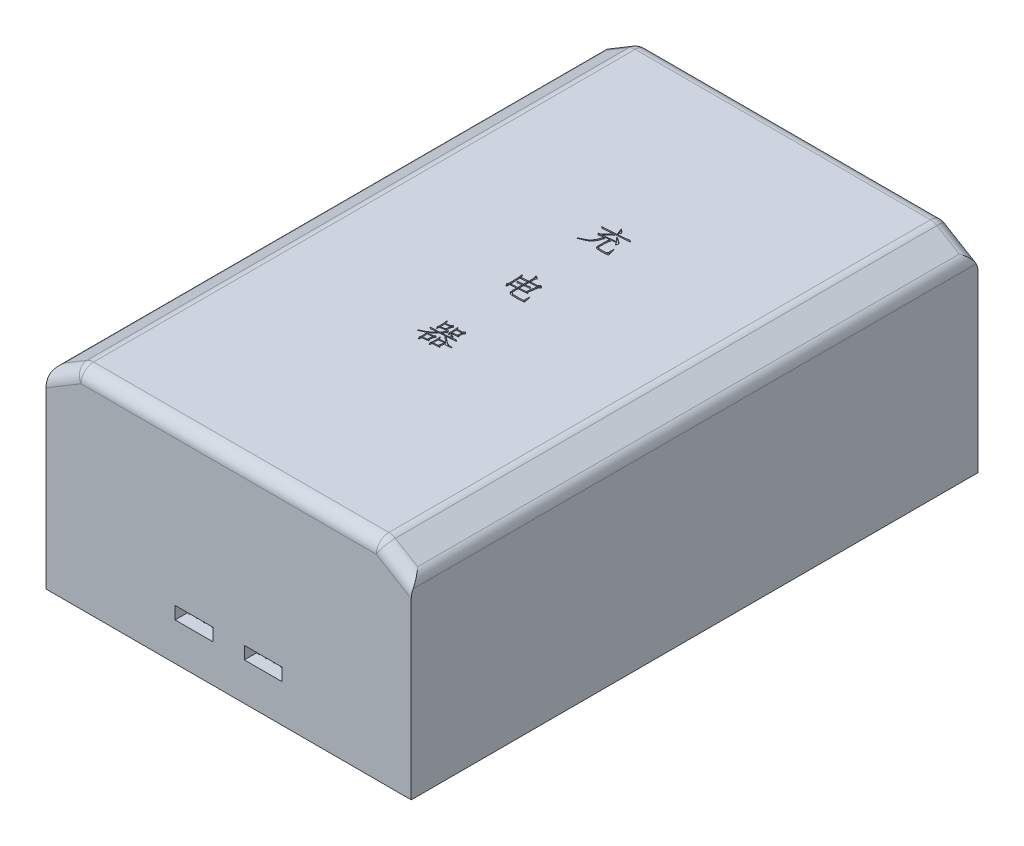
from build123d import *

# Parameters (mm, degrees)
SKETCH_1_W          = 58
SKETCH_1_H          = 90
EXTRUDE_1_DEPTH     = 33
CUT_EXTRUDE_1_DEPTH = 113.040171367
FILLET_1_R          = 2
CUT_EXTRUDE_2_DEPTH = 0.2
SKETCH_4_W          = 6
SKETCH_4_H          = 2
CUT_EXTRUDE_3_DEPTH = 6
SKETCH_5_R          = 0.15
EXTRUDE_2_DEPTH     = 5
FILLET_2_R          = 0.1
CUT_EXTRUDE_4_DEPTH = 5


with BuildPart() as part:
    # 草图1 → 凸台-拉伸1 (new body)
    with BuildSketch(Plane(origin=(0, 0, 0), x_dir=(1, 0, 0), z_dir=(0, 1, 0))):
        with Locations((-29, 45)):
            Rectangle(SKETCH_1_W, SKETCH_1_H)
    extrude(amount=EXTRUDE_1_DEPTH)

    # 草图2 → 切除-拉伸1 (cut, through all)
    with BuildSketch(Plane.XY):
        Polygon((-53, 33), (-58, 30), (-58, 33), align=None)
        Polygon((0, 30), (0, 33), (-5, 33), align=None)
    extrude(amount=-CUT_EXTRUDE_1_DEPTH, mode=Mode.SUBTRACT)

    # 圆角1
    fillet_1_edges = [part.edges().sort_by_distance(p)[0] for p in [
        (-29, 33, -90),
        (-29, 33, 0),
        (-55.5, 31.5, -90),
        (-53, 33, -45),
        (-58, 30, -45),
        (-55.5, 31.5, 0),
        (-2.5, 31.5, -90),
        (0, 30, -45),
        (-5, 33, -45),
        (-2.5, 31.5, 0),
    ]]
    fillet(fillet_1_edges, radius=FILLET_1_R)

    # 草图3 → 切除-拉伸2 (cut)
    # profile 1 of 6: a face of its own
    with BuildSketch(Plane(origin=(0, 33, 0), x_dir=(1, 0, 0), z_dir=(0, 1, 0))):
        with BuildLine():
            Line((-31.113002733, 57.493892761), (-31.040660948, 57.523724425))
            add(Edge.make_bspline(
                [(-31.040660948, 57.523724425), (-30.973644608, 57.551478353), (-30.838365924, 57.607502226), (-30.636604807, 57.698393291), (-30.434289975, 57.796832022), (-30.26548757, 57.882018347), (-30.133171269, 57.955595568), (-30.039408624, 58.015598601), (-29.950051839, 58.077840953), (-29.867497656, 58.145127689), (-29.790508957, 58.215778503), (-29.717521496, 58.288515657), (-29.651404636, 58.366159349), (-29.591443912, 58.446843309), (-29.536356817, 58.52736139), (-29.485365434, 58.605547632), (-29.439996139, 58.68152276), (-29.397579946, 58.753901661), (-29.362509679, 58.824960577), (-29.33040099, 58.892162878), (-29.304336756, 58.95728534), (-29.276675793, 59.038140258), (-29.249521137, 59.131401083), (-29.218625179, 59.231330154), (-29.196685652, 59.317693785), (-29.178967486, 59.389729941), (-29.166742502, 59.44941408), (-29.155897923, 59.497005057), (-29.148643528, 59.53364444), (-29.144371619, 59.554268497), (-29.142621314, 59.562718672)],
                knots=[0, 0, 0, 0, 2.061159307, 4.160640874, 6.287012338, 8.454376887, 9.533022146, 10.587381967, 11.616374519, 12.625880149, 13.610966308, 14.585048418, 15.552034607, 16.505717542, 17.440399167, 18.324116836, 19.157646495, 19.955007434, 20.70691773, 21.408529353, 22.070995169, 22.69876626, 23.836209216, 24.830874226, 25.67045884, 26.367825475, 26.938681821, 27.401489014, 27.754775552, 28, 28, 28, 28], degree=3))
            Line((-29.142621314, 59.562718672), (-29.134417606, 59.698452744))
            Line((-29.134417606, 59.698452744), (-29.366358795, 59.648484707))
            Line((-29.366358795, 59.648484707), (-29.639318523, 59.588075587))
            Line((-29.639318523, 59.588075587), (-29.855598088, 59.532887008))
            Line((-29.855598088, 59.532887008), (-29.911532458, 59.593296128))
            Line((-29.911532458, 59.593296128), (-30.055470238, 59.749166573))
            add(Edge.make_bspline(
                [(-30.055470238, 59.749166573), (-30.062782404, 59.758926519), (-30.073741764, 59.773554574), (-30.094438641, 59.789310611), (-30.08932135, 59.802660284), (-30.075680473, 59.807429131), (-30.05699625, 59.816251947), (-30.040940423, 59.821462118), (-30.031604907, 59.824491525)],
                knots=[0, 0, 0, 0, 1.81508851, 2.720426484, 3.020159823, 3.633829035, 4.624211136, 6, 6, 6, 6], degree=3))
            Line((-30.031604907, 59.824491525), (-29.863056004, 59.84984844))
            add(Edge.make_bspline(
                [(-29.863056004, 59.84984844), (-29.85092535, 59.85362833), (-29.823104523, 59.86229725), (-29.781273457, 59.888907951), (-29.73169467, 59.924099708), (-29.675270592, 59.970641177), (-29.611947753, 60.028496219), (-29.541475869, 60.097053409), (-29.463462761, 60.176225238), (-29.3827455, 60.264513794), (-29.301701608, 60.353260992), (-29.226943209, 60.436578966), (-29.159921341, 60.510338945), (-29.103113145, 60.576013373), (-29.053845488, 60.631781679), (-29.015011567, 60.679799543), (-28.982836134, 60.717465769), (-28.965764801, 60.740739016), (-28.958410788, 60.750764698)],
                knots=[0, 0, 0, 0, 0.47279427, 1.084321388, 1.836616624, 2.747281282, 3.812159307, 5.040032267, 6.41881215, 7.962793582, 9.507333254, 10.90761013, 12.143635294, 13.229317833, 14.150804513, 14.922334459, 15.535761718, 16, 16, 16, 16], degree=3))
            Line((-28.958410788, 60.750764698), (-28.845796255, 60.906635143))
            add(Edge.make_bspline(
                [(-28.845796255, 60.906635143), (-28.932318543, 60.900817912), (-29.099196752, 60.889598039), (-29.34010246, 60.870985867), (-29.562600894, 60.851546606), (-29.767048154, 60.831917188), (-29.953160178, 60.809860246), (-30.121388882, 60.788889709), (-30.271024299, 60.76579023), (-30.364506258, 60.748947223), (-30.408229667, 60.741069407)],
                knots=[0, 0, 0, 0, 1.323898549, 2.553444044, 3.688737392, 4.733683834, 5.688868987, 6.549873273, 7.321746311, 8, 8, 8, 8], degree=3))
            Line((-30.408229667, 60.741069407), (-30.640170856, 60.891719311))
            add(Edge.make_bspline(
                [(-30.640170856, 60.891719311), (-30.648365047, 60.897110244), (-30.66304678, 60.90676931), (-30.682673527, 60.920602203), (-30.693568218, 60.932771935), (-30.703181443, 60.944234287), (-30.692698767, 60.957273468), (-30.67065336, 60.960910984), (-30.636582874, 60.968787501), (-30.608687251, 60.970984956), (-30.592440193, 60.972264805)],
                knots=[0, 0, 0, 0, 1.205272087, 2.159515554, 2.868960972, 3.317653652, 3.713881685, 4.588861437, 6.013273903, 8, 8, 8, 8], degree=3))
            Line((-30.592440193, 60.972264805), (-29.518500283, 61.043115007))
            Line((-29.518500283, 61.043115007), (-27.900878293, 61.153492165))
            add(Edge.make_bspline(
                [(-27.900878293, 61.153492165), (-27.831744274, 61.158154538), (-27.698092036, 61.167167996), (-27.505169708, 61.185225175), (-27.32639594, 61.205354463), (-27.161891915, 61.227140031), (-27.011723295, 61.252663933), (-26.87576414, 61.279843365), (-26.753953524, 61.309935206), (-26.678419924, 61.333856854), (-26.642727856, 61.345160607)],
                knots=[0, 0, 0, 0, 1.303486438, 2.519944373, 3.644788666, 4.687821508, 5.641194449, 6.509767222, 7.295816826, 8, 8, 8, 8], degree=3))
            Line((-26.642727856, 61.345160607), (-26.354852296, 61.168407997))
            add(Edge.make_bspline(
                [(-26.354852296, 61.168407997), (-26.348170975, 61.16061061), (-26.335755601, 61.14612134), (-26.323493963, 61.123553519), (-26.33084189, 61.103968452), (-26.351536783, 61.096472944), (-26.380644514, 61.090179044), (-26.40494037, 61.088711289), (-26.418990374, 61.087862503)],
                knots=[0, 0, 0, 0, 1.164271997, 2.163475098, 2.611190826, 3.305674305, 4.441903525, 6, 6, 6, 6], degree=3))
            Line((-26.418990374, 61.087862503), (-28.621312983, 60.937212599))
            Line((-28.621312983, 60.937212599), (-28.48557891, 60.730628325))
            add(Edge.make_bspline(
                [(-28.48557891, 60.730628325), (-28.5095454, 60.722447913), (-28.554401786, 60.707137215), (-28.616381716, 60.681424322), (-28.669029142, 60.656072047), (-28.707982781, 60.63229174), (-28.738590836, 60.60993108), (-28.766176723, 60.586145752), (-28.800274969, 60.556334389), (-28.841443815, 60.521005686), (-28.887582887, 60.477826396), (-28.940608883, 60.428951982), (-28.999203125, 60.372919281), (-29.085052461, 60.291220696), (-29.193069584, 60.18686769), (-29.322730129, 60.067236676), (-29.445855763, 59.952883829), (-29.527338858, 59.880055582), (-29.566976737, 59.844627899)],
                knots=[0, 0, 0, 0, 0.86220945, 1.613736529, 2.283893778, 2.85017155, 3.16512732, 3.573784831, 4.089867621, 4.707890261, 5.420901712, 6.241586036, 7.163804253, 8.181775789, 10.27756688, 12.278318206, 14.189568384, 16, 16, 16, 16], degree=3))
            Line((-29.566976737, 59.844627899), (-28.237230306, 59.985582512))
            Line((-28.237230306, 59.985582512), (-27.492184493, 60.071348546))
            Line((-27.492184493, 60.071348546), (-27.780805844, 60.383089437))
            Line((-27.780805844, 60.383089437), (-28.012747033, 60.609810085))
            Line((-28.012747033, 60.609810085), (-28.068681404, 60.670219205))
            Line((-28.068681404, 60.670219205), (-28.012747033, 60.725407784))
            Line((-28.012747033, 60.725407784), (-27.900878293, 60.655303373))
            Line((-27.900878293, 60.655303373), (-27.580187903, 60.443498557))
            Line((-27.580187903, 60.443498557), (-27.291566552, 60.237660074))
            Line((-27.291566552, 60.237660074), (-27.099898109, 60.101180211))
            add(Edge.make_bspline(
                [(-27.099898109, 60.101180211), (-27.085633775, 60.090383999), (-27.060001731, 60.070983936), (-27.027137646, 60.043361375), (-27.006247107, 60.018666283), (-26.993843025, 59.995900932), (-26.993129377, 59.970591839), (-26.992617539, 59.940049715), (-26.997166516, 59.900428875), (-27.00137016, 59.871204027), (-27.003690992, 59.855068981)],
                knots=[0, 0, 0, 0, 1.47326346, 2.647354849, 3.519729378, 4.132847574, 4.729354513, 5.568215301, 6.657411107, 8, 8, 8, 8], degree=3))
            Line((-27.003690992, 59.855068981), (-27.043217947, 59.643264165))
            add(Edge.make_bspline(
                [(-27.043217947, 59.643264165), (-27.04580919, 59.632057467), (-27.050523063, 59.611670738), (-27.058711841, 59.584729957), (-27.068804068, 59.565803265), (-27.079632864, 59.549180103), (-27.104163838, 59.544418974), (-27.116703593, 59.556127055), (-27.123763441, 59.562718672)],
                knots=[0, 0, 0, 0, 1.399593052, 2.546077493, 3.397405988, 4.020252999, 4.885407846, 6, 6, 6, 6], degree=3))
            Line((-27.123763441, 59.562718672), (-27.195359435, 59.678316371))
            Line((-27.195359435, 59.678316371), (-27.379569961, 59.930393933))
            Line((-27.379569961, 59.930393933), (-27.972474287, 59.859543731))
            Line((-27.972474287, 59.859543731), (-28.269299345, 59.819270984))
            Line((-28.269299345, 59.819270984), (-27.980677994, 59.593296128))
            add(Edge.make_bspline(
                [(-27.980677994, 59.593296128), (-27.995393096, 59.578673068), (-28.023192543, 59.551047506), (-28.053965324, 59.512608073), (-28.073203295, 59.476161572), (-28.083174375, 59.438711132), (-28.093739268, 59.392022533), (-28.102006414, 59.337644568), (-28.108061874, 59.28109614), (-28.113553362, 59.227685626), (-28.116807668, 59.179423775), (-28.117045091, 59.149057216), (-28.117157858, 59.134634291)],
                knots=[0, 0, 0, 0, 1.257321427, 2.375304013, 2.968287562, 3.740371106, 4.712725181, 5.871977008, 7.06994215, 8.15985633, 9.12600395, 10, 10, 10, 10], degree=3))
            Line((-28.117157858, 59.134634291), (-28.149226897, 58.118120334))
            add(Edge.make_bspline(
                [(-28.149226897, 58.118120334), (-28.151039257, 58.111699806), (-28.155433511, 58.096132571), (-28.153637665, 58.072919443), (-28.14952257, 58.04831389), (-28.146161657, 58.021303247), (-28.139565597, 57.987935311), (-28.134205021, 57.948094953), (-28.122707995, 57.90517068), (-28.102255505, 57.862201717), (-28.072913043, 57.821599706), (-28.044141785, 57.786549931), (-28.009291292, 57.762735496), (-27.971056789, 57.747912633), (-27.921890446, 57.734435927), (-27.861113252, 57.724754457), (-27.788890674, 57.717543423), (-27.705541017, 57.712595404), (-27.610540107, 57.709442038), (-27.543398179, 57.709919505), (-27.507846117, 57.710172326)],
                knots=[0, 0, 0, 0, 0.394828134, 0.957301572, 1.361175884, 1.884322116, 2.575192127, 3.385241455, 4.27551277, 5.208768111, 6.197943431, 7.255992943, 7.883942779, 8.686388392, 9.684378101, 10.915273482, 12.343453113, 14.003929471, 15.884056182, 18, 18, 18, 18], degree=3))
            add(Edge.make_bspline(
                [(-27.507846117, 57.710172326), (-27.450664129, 57.710122967), (-27.342997991, 57.710030029), (-27.19161032, 57.714357132), (-27.060490532, 57.718583662), (-26.950118416, 57.727096006), (-26.86015661, 57.736024091), (-26.790785263, 57.747544011), (-26.740925765, 57.759946737), (-26.700669885, 57.78176896), (-26.673507818, 57.821570851), (-26.648170466, 57.872281564), (-26.633117057, 57.93444184), (-26.629170885, 57.97884215), (-26.627066232, 58.002522635)],
                knots=[0, 0, 0, 0, 1.95991926, 3.690269324, 5.191205189, 6.455837281, 7.484377104, 8.288501433, 8.865564481, 9.239726547, 9.82794371, 10.472021542, 11.185067124, 12, 12, 12, 12], degree=3))
            Line((-26.627066232, 58.002522635), (-26.627066232, 58.691634078))
            Line((-26.627066232, 58.691634078), (-26.618862524, 58.757263739))
            Line((-26.618862524, 58.757263739), (-26.539062823, 58.76248428))
            Line((-26.539062823, 58.76248428), (-26.5144517, 58.676718246))
            Line((-26.5144517, 58.676718246), (-26.402582959, 58.15317254))
            Line((-26.402582959, 58.15317254), (-26.31457955, 57.765360905))
            Line((-26.31457955, 57.765360905), (-26.274306803, 57.624406292))
            add(Edge.make_bspline(
                [(-26.274306803, 57.624406292), (-26.277962157, 57.618401571), (-26.285977859, 57.60523402), (-26.306772205, 57.590410559), (-26.331980624, 57.575276745), (-26.364277519, 57.562027097), (-26.402639513, 57.549544259), (-26.447860762, 57.538651148), (-26.499050476, 57.528121567), (-26.55710256, 57.519450741), (-26.621473319, 57.511185411), (-26.692369614, 57.504583874), (-26.769727861, 57.499542663), (-26.853515232, 57.495155509), (-26.943998266, 57.491256909), (-27.04096971, 57.489105295), (-27.144396243, 57.488553481), (-27.215495852, 57.488631909), (-27.252039597, 57.48867222)],
                knots=[0, 0, 0, 0, 0.332524827, 0.729182477, 1.197342196, 1.73966079, 2.388956609, 3.122971664, 3.958572195, 4.883463908, 5.924228283, 7.056767034, 8.28202379, 9.625033149, 11.062325413, 12.605617786, 14.255356959, 16, 16, 16, 16], degree=3))
            add(Edge.make_bspline(
                [(-27.252039597, 57.48867222), (-27.315438371, 57.489094873), (-27.435057165, 57.489892321), (-27.604155882, 57.495901632), (-27.752497879, 57.504850498), (-27.880147394, 57.518908141), (-27.987535484, 57.535931007), (-28.074013607, 57.557708291), (-28.141106527, 57.582388663), (-28.199187633, 57.621626543), (-28.246528678, 57.672083286), (-28.291133384, 57.723644829), (-28.32314761, 57.765664216), (-28.342050832, 57.81549682), (-28.3491013, 57.878548531), (-28.359716818, 57.942177888), (-28.365469995, 57.994032544), (-28.367627068, 58.025310054), (-28.368756055, 58.047429372), (-28.366389522, 58.058719065), (-28.365506462, 58.062931755)],
                knots=[0, 0, 0, 0, 2.346713137, 4.427703807, 6.262836898, 7.846089821, 9.180402993, 10.282973817, 11.145918589, 11.809495769, 12.857128423, 13.692550747, 14.340894988, 14.795448151, 15.645689873, 16.677686556, 17.186808054, 17.574283458, 17.841146092, 18, 18, 18, 18], degree=3))
            Line((-28.365506462, 58.062931755), (-28.365506462, 58.147951998))
            Line((-28.365506462, 58.147951998), (-28.333437423, 59.180127579))
            add(Edge.make_bspline(
                [(-28.333437423, 59.180127579), (-28.33355656, 59.203498599), (-28.333825329, 59.256222898), (-28.337564549, 59.343950473), (-28.340800014, 59.448126354), (-28.345093104, 59.541813486), (-28.346613819, 59.615677812), (-28.348275171, 59.660659658), (-28.349202894, 59.693725629), (-28.349128121, 59.711628132), (-28.349099047, 59.718589117)],
                knots=[0, 0, 0, 0, 1.041113228, 2.348719285, 3.911282286, 5.684535143, 6.526530033, 7.202470855, 7.689898713, 8, 8, 8, 8], degree=3))
            Line((-28.349099047, 59.718589117), (-28.381168086, 59.819270984))
            Line((-28.381168086, 59.819270984), (-29.014345158, 59.714114368))
            Line((-29.014345158, 59.714114368), (-28.789861885, 59.512750635))
            add(Edge.make_bspline(
                [(-28.789861885, 59.512750635), (-28.803825968, 59.500655079), (-28.828182238, 59.47955791), (-28.859471393, 59.4447357), (-28.881894068, 59.401650262), (-28.903448825, 59.349582214), (-28.924864716, 59.291382564), (-28.94204357, 59.253376772), (-28.95020708, 59.235316158)],
                knots=[0, 0, 0, 0, 1.02237023, 1.783226751, 2.571439814, 3.692993896, 4.903694781, 6, 6, 6, 6], degree=3))
            Line((-28.95020708, 59.235316158), (-29.053872113, 58.938491099))
            add(Edge.make_bspline(
                [(-29.053872113, 58.938491099), (-29.071743846, 58.895494852), (-29.109592223, 58.804438309), (-29.180510602, 58.665680131), (-29.265452531, 58.516374786), (-29.345018882, 58.385941835), (-29.419574336, 58.279314835), (-29.486892839, 58.201053823), (-29.563994469, 58.12674581), (-29.649920751, 58.055470051), (-29.744522958, 57.986697476), (-29.849409974, 57.922252949), (-29.96288344, 57.860176331), (-30.124395555, 57.783576067), (-30.327355346, 57.695694972), (-30.564413531, 57.597993234), (-30.789543273, 57.509825709), (-30.937084883, 57.458405021), (-31.008591909, 57.433483641)],
                knots=[0, 0, 0, 0, 0.867378823, 1.836916522, 2.90104065, 4.068222218, 4.682652781, 5.323277335, 5.988292146, 6.675710901, 7.402165728, 8.165719603, 8.967975304, 9.811231328, 11.495559834, 13.088750289, 14.589043389, 16, 16, 16, 16], degree=3))
            Line((-31.008591909, 57.433483641), (-31.080933694, 57.408126727))
            Line((-31.080933694, 57.408126727), (-31.113002733, 57.493892761))
        make_face()
    # profile 2 of 6: a face of its own
    with BuildSketch(Plane(origin=(0, 33, 0), x_dir=(1, 0, 0), z_dir=(0, 1, 0))):
        with BuildLine():
            Line((-28.821930924, 62.225940492), (-28.813727216, 62.225940492))
            Line((-28.813727216, 62.225940492), (-28.701858476, 62.120038084))
            Line((-28.701858476, 62.120038084), (-28.469171495, 61.898537977))
            Line((-28.469171495, 61.898537977), (-28.3088263, 61.737446991))
            add(Edge.make_bspline(
                [(-28.3088263, 61.737446991), (-28.299253179, 61.726118189), (-28.282459994, 61.706245185), (-28.261864424, 61.6787541), (-28.248176837, 61.658822282), (-28.240756711, 61.642762559), (-28.241340914, 61.627476618), (-28.246576088, 61.609688192), (-28.256479403, 61.587239373), (-28.26474839, 61.570598637), (-28.269299345, 61.561440172)],
                knots=[0, 0, 0, 0, 1.749748456, 3.06941174, 4.045570599, 4.611946852, 5.110486315, 5.80755383, 6.793356163, 8, 8, 8, 8], degree=3))
            Line((-28.269299345, 61.561440172), (-28.381168086, 61.325024234))
            add(Edge.make_bspline(
                [(-28.381168086, 61.325024234), (-28.387339226, 61.31217096), (-28.398264672, 61.289415403), (-28.416332442, 61.261521537), (-28.431908181, 61.241979), (-28.451903678, 61.231590554), (-28.474291944, 61.232748196), (-28.493137499, 61.243475891), (-28.502572376, 61.260667069), (-28.510395597, 61.279330121), (-28.517699863, 61.305003562), (-28.522438849, 61.324018346), (-28.525105866, 61.334719524)],
                knots=[0, 0, 0, 0, 1.655558413, 2.931016202, 3.872600528, 4.519283298, 5.474098966, 6.35700451, 6.902676029, 7.719137036, 8.716371353, 10, 10, 10, 10], degree=3))
            Line((-28.525105866, 61.334719524), (-28.581786027, 61.515946884))
            add(Edge.make_bspline(
                [(-28.581786027, 61.515946884), (-28.589340313, 61.540607629), (-28.603595958, 61.587144769), (-28.626001428, 61.652049174), (-28.647232961, 61.708211273), (-28.662665657, 61.741990685), (-28.669789437, 61.757583364)],
                knots=[0, 0, 0, 0, 1.202362732, 2.268971327, 3.200951906, 4, 4, 4, 4], degree=3))
            Line((-28.669789437, 61.757583364), (-28.749589138, 61.944031265))
            add(Edge.make_bspline(
                [(-28.749589138, 61.944031265), (-28.759161894, 61.963614541), (-28.776307991, 61.998690833), (-28.79723768, 62.045474574), (-28.813411306, 62.078956433), (-28.819567854, 62.09786469), (-28.821930924, 62.105122252)],
                knots=[0, 0, 0, 0, 1.479948644, 2.650787826, 3.482131469, 4, 4, 4, 4], degree=3))
            Line((-28.821930924, 62.105122252), (-28.869661587, 62.185667745))
            Line((-28.869661587, 62.185667745), (-28.821930924, 62.225940492))
        make_face()
    # profile 3 of 6: a face of its own
    with BuildSketch(Plane(origin=(0, 33, 0), x_dir=(1, 0, 0), z_dir=(0, 1, 0))):
        with BuildLine():
            Line((-30.320226258, 48.045032757), (-30.215815433, 47.798175736))
            Line((-30.215815433, 47.798175736), (-30.127812024, 47.58189617))
            Line((-30.127812024, 47.58189617), (-29.823529049, 47.602032544))
            Line((-29.823529049, 47.602032544), (-29.182148269, 47.652000581))
            Line((-29.182148269, 47.652000581), (-29.014345158, 47.672136955))
            Line((-29.014345158, 47.672136955), (-29.00614145, 48.135273541))
            add(Edge.make_bspline(
                [(-29.00614145, 48.135273541), (-29.006122542, 48.13925135), (-29.006063435, 48.151685659), (-29.007073837, 48.17704222), (-29.008524921, 48.215822038), (-29.010651726, 48.267302132), (-29.014196737, 48.330006483), (-29.020642715, 48.402244189), (-29.032646251, 48.48265982), (-29.045863284, 48.570263634), (-29.06489219, 48.662134141), (-29.09537866, 48.753438364), (-29.133171116, 48.844217334), (-29.165629777, 48.901752859), (-29.182148269, 48.931033183)],
                knots=[0, 0, 0, 0, 0.173602103, 0.542666099, 1.107290094, 1.867496485, 2.791351889, 3.848335142, 5.031397575, 6.338917201, 7.715858306, 9.119221205, 10.533946875, 12, 12, 12, 12], degree=3))
            Line((-29.182148269, 48.931033183), (-29.110552275, 49.001137594))
            Line((-29.110552275, 49.001137594), (-28.62951669, 48.658819247))
            add(Edge.make_bspline(
                [(-28.62951669, 48.658819247), (-28.653793079, 48.624750192), (-28.700243932, 48.559561887), (-28.742667205, 48.467465078), (-28.763799636, 48.385859622), (-28.774169441, 48.309839168), (-28.780655633, 48.217922414), (-28.781306452, 48.15119759), (-28.781658177, 48.115137168)],
                knots=[0, 0, 0, 0, 1.301600033, 2.49050349, 3.13102808, 3.921770199, 4.876852108, 6, 6, 6, 6], degree=3))
            Line((-28.781658177, 48.115137168), (-28.781658177, 47.692273328))
            Line((-28.781658177, 47.692273328), (-28.389371793, 47.722850784))
            Line((-28.389371793, 47.722850784), (-27.772602137, 47.778039362))
            Line((-27.772602137, 47.778039362), (-27.620460649, 47.798175736))
            Line((-27.620460649, 47.798175736), (-27.483980786, 47.974182554))
            add(Edge.make_bspline(
                [(-27.483980786, 47.974182554), (-27.478020031, 47.98261718), (-27.46768036, 47.997248089), (-27.451419482, 48.013396235), (-27.440019155, 48.024972662), (-27.427271351, 48.028417956), (-27.414548796, 48.022237277), (-27.397609556, 48.014571012), (-27.374829701, 48.001149408), (-27.35790274, 47.990626472), (-27.348246714, 47.984623637)],
                knots=[0, 0, 0, 0, 1.45678333, 2.526972177, 3.252382981, 3.72184402, 4.278208709, 5.175319814, 6.388654133, 8, 8, 8, 8], degree=3))
            Line((-27.348246714, 47.984623637), (-27.15583248, 47.848889565))
            add(Edge.make_bspline(
                [(-27.15583248, 47.848889565), (-27.146481403, 47.841086855), (-27.129965123, 47.827305369), (-27.110327907, 47.807507741), (-27.097936882, 47.790842776), (-27.094779456, 47.772450146), (-27.10109906, 47.755512304), (-27.110615515, 47.740299921), (-27.125326434, 47.726855491), (-27.144739405, 47.707798484), (-27.173529816, 47.68062475), (-27.210573878, 47.646299217), (-27.249330515, 47.60217211), (-27.281371175, 47.54557047), (-27.306578742, 47.479306887), (-27.317763166, 47.431165943), (-27.323635591, 47.405889352)],
                knots=[0, 0, 0, 0, 0.943258361, 1.666023965, 2.168845386, 2.52071473, 3.063709826, 3.523664936, 3.905435419, 4.600936746, 5.637529659, 6.974004581, 8.519600208, 10.169901079, 11.988991628, 14, 14, 14, 14], degree=3))
            Line((-27.323635591, 47.405889352), (-27.411639, 46.882343645))
            Line((-27.411639, 46.882343645), (-27.516049825, 46.242454449))
            Line((-27.516049825, 46.242454449), (-27.548118864, 46.081363462))
            Line((-27.548118864, 46.081363462), (-27.395977376, 45.94562939))
            add(Edge.make_bspline(
                [(-27.395977376, 45.94562939), (-27.390141065, 45.939531179), (-27.379631155, 45.928549644), (-27.3671217, 45.912349176), (-27.360665765, 45.8980023), (-27.358691988, 45.882675431), (-27.371517735, 45.865708936), (-27.386929249, 45.865315112), (-27.395977376, 45.865083897)],
                knots=[0, 0, 0, 0, 1.30699155, 2.353603611, 3.14677007, 3.725164491, 4.664440014, 6, 6, 6, 6], degree=3))
            Line((-27.395977376, 45.865083897), (-27.524253532, 45.859863356))
            Line((-27.524253532, 45.859863356), (-28.229026599, 45.819590609))
            Line((-28.229026599, 45.819590609), (-28.62951669, 45.789758945))
            Line((-28.62951669, 45.789758945), (-28.798065593, 45.774843113))
            Line((-28.798065593, 45.774843113), (-28.798065593, 45.231161033))
            add(Edge.make_bspline(
                [(-28.798065593, 45.231161033), (-28.796714809, 45.175940469), (-28.794094082, 45.068804194), (-28.778567201, 44.937565761), (-28.752957338, 44.840510624), (-28.721104773, 44.775730303), (-28.677047948, 44.719372711), (-28.631324697, 44.673989408), (-28.574768877, 44.647009113), (-28.51003377, 44.629517653), (-28.423114631, 44.614580888), (-28.313768459, 44.602539489), (-28.18216332, 44.593086826), (-28.028205687, 44.586911601), (-27.851684265, 44.582230636), (-27.726366864, 44.581803039), (-27.659987604, 44.581576546)],
                knots=[0, 0, 0, 0, 1.466488491, 2.845210237, 3.49707944, 4.122863907, 4.744632528, 5.394191971, 5.807441266, 6.392236624, 7.170326236, 8.14704901, 9.311880911, 10.672856686, 12.237648496, 14, 14, 14, 14], degree=3))
            add(Edge.make_bspline(
                [(-27.659987604, 44.581576546), (-27.627918601, 44.581592701), (-27.565769371, 44.58162401), (-27.475278409, 44.58140456), (-27.390751227, 44.58216124), (-27.311940506, 44.58362077), (-27.23909624, 44.585839491), (-27.171959052, 44.588686975), (-27.110830395, 44.592662824), (-27.055351413, 44.596124314), (-27.005617064, 44.600582807), (-26.961803207, 44.605561248), (-26.923779403, 44.611747617), (-26.891525793, 44.61788965), (-26.865230467, 44.625590717), (-26.844389918, 44.63265808), (-26.829181172, 44.641159025), (-26.802067728, 44.669756848), (-26.777825723, 44.728800727), (-26.767756323, 44.785074681), (-26.762800304, 44.812771943)],
                knots=[0, 0, 0, 0, 1.69250474, 3.280047945, 4.775807352, 6.153677374, 7.440058486, 8.62204141, 9.699895309, 10.673003226, 11.555573864, 12.335094356, 12.999447804, 13.588689041, 14.06627123, 14.444032517, 14.750045345, 14.972702383, 16.510005953, 18, 18, 18, 18], degree=3))
            Line((-26.762800304, 44.812771943), (-26.762800304, 45.09020642))
            Line((-26.762800304, 45.09020642), (-26.762800304, 45.527986092))
            Line((-26.762800304, 45.527986092), (-26.667338979, 45.537681383))
            Line((-26.667338979, 45.537681383), (-26.650931563, 45.416863143))
            Line((-26.650931563, 45.416863143), (-26.610658817, 45.21102466))
            Line((-26.610658817, 45.21102466), (-26.554724446, 44.938810724))
            Line((-26.554724446, 44.938810724), (-26.498790076, 44.707615327))
            Line((-26.498790076, 44.707615327), (-26.458517329, 44.541303799))
            add(Edge.make_bspline(
                [(-26.458517329, 44.541303799), (-26.454630134, 44.527567045), (-26.448407288, 44.505576457), (-26.446856768, 44.472408566), (-26.469934673, 44.453738601), (-26.48782711, 44.448842431), (-26.498790076, 44.445842473)],
                knots=[0, 0, 0, 0, 1.388089821, 2.222134124, 2.9106747, 4, 4, 4, 4], degree=3))
            Line((-26.498790076, 44.445842473), (-26.562928154, 44.43018085))
            add(Edge.make_bspline(
                [(-26.562928154, 44.43018085), (-26.570614721, 44.428338505), (-26.588838359, 44.423970597), (-26.621088956, 44.41937428), (-26.662261836, 44.41299758), (-26.713081018, 44.407534051), (-26.773423568, 44.400464919), (-26.843354269, 44.394211625), (-26.922356903, 44.386454374), (-27.039407604, 44.376665746), (-27.189767326, 44.36608894), (-27.369315346, 44.358238068), (-27.544362559, 44.352926404), (-27.659736078, 44.35421837), (-27.716667766, 44.354855898)],
                knots=[0, 0, 0, 0, 0.245704709, 0.582527055, 1.012223486, 1.541577967, 2.171667446, 2.901733534, 3.724890601, 4.640454678, 6.554604577, 8.412065627, 10.229514332, 12, 12, 12, 12], degree=3))
            add(Edge.make_bspline(
                [(-27.716667766, 44.354855898), (-27.780063016, 44.355112533), (-27.90065599, 44.355600714), (-28.071730543, 44.359998995), (-28.223194443, 44.367149937), (-28.355037437, 44.377382719), (-28.467597257, 44.390312777), (-28.560828638, 44.406244149), (-28.634967634, 44.424454128), (-28.705318542, 44.453799252), (-28.771246126, 44.495841071), (-28.837879926, 44.543552135), (-28.889802873, 44.59195019), (-28.927488915, 44.642559403), (-28.953539372, 44.696062887), (-28.975035534, 44.752097234), (-28.99317244, 44.812397767), (-29.011769555, 44.899776233), (-29.02670488, 45.01637642), (-29.02888787, 45.11153596), (-29.030006782, 45.160310831)],
                knots=[0, 0, 0, 0, 1.876083217, 3.568760327, 5.064034739, 6.362950224, 7.481716667, 8.415471475, 9.161396398, 9.735239497, 10.662596259, 11.46746951, 12.159532553, 12.753991537, 13.323194191, 13.914778179, 14.529249753, 15.184391318, 16.556834653, 18, 18, 18, 18], degree=3))
            Line((-29.030006782, 45.160310831), (-29.030006782, 45.754706739))
            Line((-29.030006782, 45.754706739), (-29.270151678, 45.739045116))
            Line((-29.270151678, 45.739045116), (-29.84739438, 45.683856537))
            Line((-29.84739438, 45.683856537), (-30.055470238, 45.663720164))
            Line((-30.055470238, 45.663720164), (-30.063673946, 45.436999516))
            Line((-30.063673946, 45.436999516), (-30.071877653, 45.306485985))
            add(Edge.make_bspline(
                [(-30.071877653, 45.306485985), (-30.073066833, 45.286980342), (-30.075389993, 45.248874478), (-30.09252334, 45.208276424), (-30.113265433, 45.179387383), (-30.1391571, 45.183561791), (-30.161968671, 45.203982378), (-30.175583257, 45.223770857), (-30.183746394, 45.235635783)],
                knots=[0, 0, 0, 0, 1.537008902, 3.002672259, 3.591479903, 4.088718085, 4.854019086, 6, 6, 6, 6], degree=3))
            Line((-30.183746394, 45.235635783), (-30.303818842, 45.407167852))
            Line((-30.303818842, 45.407167852), (-30.383618544, 45.517545009))
            add(Edge.make_bspline(
                [(-30.383618544, 45.517545009), (-30.391635468, 45.528778957), (-30.404104305, 45.546251277), (-30.422971841, 45.569110471), (-30.415933767, 45.59111549), (-30.402081035, 45.614869761), (-30.380937358, 45.651687085), (-30.362228246, 45.678814118), (-30.351549505, 45.694297619)],
                knots=[0, 0, 0, 0, 1.23820676, 1.925800805, 2.324941475, 3.128488194, 4.361005507, 6, 6, 6, 6], degree=3))
            add(Edge.make_bspline(
                [(-30.351549505, 45.694297619), (-30.345137161, 45.703510445), (-30.331861678, 45.722583769), (-30.319838395, 45.757791115), (-30.310537624, 45.797731931), (-30.307501034, 45.85765644), (-30.303762533, 45.93068031), (-30.300884201, 46.01055372), (-30.295976176, 46.074599837), (-30.295719944, 46.111686759), (-30.295615135, 46.12685675)],
                knots=[0, 0, 0, 0, 0.607377282, 1.257453885, 2.005009611, 2.832126226, 4.50981871, 5.984390082, 7.175537241, 8, 8, 8, 8], degree=3))
            Line((-30.295615135, 46.12685675), (-30.303818842, 46.504227302))
            Line((-30.303818842, 46.504227302), (-30.327684174, 46.977804971))
            add(Edge.make_bspline(
                [(-30.327684174, 46.977804971), (-30.327598349, 46.983774005), (-30.327394299, 46.99796552), (-30.329523954, 47.022039899), (-30.33060173, 47.052151468), (-30.332972097, 47.087947031), (-30.336249312, 47.129921509), (-30.338596853, 47.177981672), (-30.34377849, 47.231837896), (-30.348945659, 47.308487493), (-30.357126209, 47.399417279), (-30.364990097, 47.496669895), (-30.372287784, 47.57450302), (-30.378390829, 47.629193649), (-30.383903799, 47.668651435), (-30.388194585, 47.70177747), (-30.394438167, 47.740233123), (-30.400874493, 47.78431653), (-30.409244243, 47.833765204), (-30.419106457, 47.88888103), (-30.429411717, 47.949811509), (-30.436572431, 47.992329757), (-30.440298706, 48.014455301)],
                knots=[0, 0, 0, 0, 0.342988187, 0.815462281, 1.387823372, 2.075138237, 2.877483005, 3.808166596, 4.840697769, 5.98720273, 8.224353604, 10.088845312, 11.596208589, 12.718316078, 13.251895789, 13.886526925, 14.638411134, 15.491344056, 16.447572081, 17.521313964, 18.710147281, 20, 20, 20, 20], degree=3))
            Line((-30.440298706, 48.014455301), (-30.320226258, 48.045032757))
        make_face()
        with BuildLine():
            Line((-30.055470238, 45.870304438), (-29.030006782, 45.94562939))
            Line((-29.030006782, 45.94562939), (-29.021803074, 46.645181915))
            Line((-29.021803074, 46.645181915), (-29.238082639, 46.615350251))
            Line((-29.238082639, 46.615350251), (-29.486431244, 46.575077504))
            Line((-29.486431244, 46.575077504), (-29.710914517, 46.524363675))
            Line((-29.710914517, 46.524363675), (-29.766848887, 46.575077504))
            Line((-29.766848887, 46.575077504), (-29.903328751, 46.685454662))
            add(Edge.make_bspline(
                [(-29.903328751, 46.685454662), (-29.911842789, 46.690523686), (-29.925292513, 46.698531283), (-29.935454361, 46.721295103), (-29.918312422, 46.737913469), (-29.903838379, 46.740082988), (-29.895125043, 46.741389032)],
                knots=[0, 0, 0, 0, 1.308059797, 2.066357273, 2.835952169, 4, 4, 4, 4], degree=3))
            Line((-29.895125043, 46.741389032), (-29.6147074, 46.766000155))
            Line((-29.6147074, 46.766000155), (-29.286559094, 46.79135707))
            Line((-29.286559094, 46.79135707), (-29.021803074, 46.821934525))
            Line((-29.021803074, 46.821934525), (-29.014345158, 47.475993763))
            Line((-29.014345158, 47.475993763), (-29.254490055, 47.450636848))
            Line((-29.254490055, 47.450636848), (-29.79146001, 47.405889352))
            Line((-29.79146001, 47.405889352), (-30.119608316, 47.370091355))
            Line((-30.119608316, 47.370091355), (-30.103946692, 46.977804971))
            Line((-30.103946692, 46.977804971), (-30.055470238, 45.870304438))
        make_face(mode=Mode.SUBTRACT)
        with BuildLine():
            Line((-28.798065593, 45.965765764), (-28.220822891, 46.00603851))
            Line((-28.220822891, 46.00603851), (-27.948608955, 46.036615966))
            Line((-27.948608955, 46.036615966), (-27.78826376, 46.056752339))
            Line((-27.78826376, 46.056752339), (-27.748736805, 46.298388819))
            Line((-27.748736805, 46.298388819), (-27.684598727, 46.705591035))
            Line((-27.684598727, 46.705591035), (-27.604053234, 47.320123317))
            Line((-27.604053234, 47.320123317), (-27.564526279, 47.587116712))
            Line((-27.564526279, 47.587116712), (-27.940405248, 47.561759797))
            Line((-27.940405248, 47.561759797), (-28.789861885, 47.490909595))
            Line((-28.789861885, 47.490909595), (-28.798065593, 46.85176619))
            add(Edge.make_bspline(
                [(-28.798065593, 46.85176619), (-28.758771126, 46.857631228), (-28.682853934, 46.868962524), (-28.573241608, 46.887003713), (-28.471896745, 46.904355939), (-28.379609295, 46.923527078), (-28.295576753, 46.940854258), (-28.220347119, 46.959772956), (-28.153282973, 46.97790312), (-28.111887077, 46.991560539), (-28.092546735, 46.997941344)],
                knots=[0, 0, 0, 0, 1.321771283, 2.553671644, 3.695876454, 4.742087807, 5.689442876, 6.550000343, 7.322553877, 8, 8, 8, 8], degree=3))
            Line((-28.092546735, 46.997941344), (-27.87626717, 46.831629816))
            add(Edge.make_bspline(
                [(-27.87626717, 46.831629816), (-27.870374937, 46.826339324), (-27.85959515, 46.816660417), (-27.847513605, 46.80130667), (-27.84067788, 46.787093354), (-27.838735866, 46.770389523), (-27.855179582, 46.751505678), (-27.873418734, 46.751243308), (-27.884470877, 46.751084323)],
                knots=[0, 0, 0, 0, 1.153778687, 2.110827697, 2.824885965, 3.44221512, 4.450092124, 6, 6, 6, 6], degree=3))
            Line((-27.884470877, 46.751084323), (-27.99708541, 46.745863782))
            Line((-27.99708541, 46.745863782), (-28.261095638, 46.725727409))
            Line((-28.261095638, 46.725727409), (-28.517647949, 46.705591035))
            Line((-28.517647949, 46.705591035), (-28.798065593, 46.67053883))
            Line((-28.798065593, 46.67053883), (-28.798065593, 45.965765764))
        make_face(mode=Mode.SUBTRACT)
    # profile 4 of 6: a face of its own
    with BuildSketch(Plane(origin=(0, 33, 0), x_dir=(1, 0, 0), z_dir=(0, 1, 0))):
        with BuildLine():
            Line((-31.104799026, 32.177890204), (-30.920588499, 32.262910447))
            add(Edge.make_bspline(
                [(-30.920588499, 32.262910447), (-30.863059424, 32.289540512), (-30.751248266, 32.341297617), (-30.590280635, 32.42019735), (-30.441170383, 32.49770409), (-30.30374983, 32.573197589), (-30.177458536, 32.645803171), (-30.063464694, 32.717481573), (-29.960627725, 32.786666236), (-29.870136229, 32.854685566), (-29.789643662, 32.9186133), (-29.717524267, 32.975757998), (-29.65409668, 33.026431639), (-29.599723559, 33.070514427), (-29.553809973, 33.107563064), (-29.517567844, 33.139279592), (-29.488755574, 33.163353693), (-29.462651411, 33.189022765), (-29.433326409, 33.217886081), (-29.39885645, 33.255483089), (-29.35970495, 33.296397761), (-29.332760315, 33.325378971), (-29.318628133, 33.340579316)],
                knots=[0, 0, 0, 0, 1.956186635, 3.801964287, 5.531264302, 7.141455942, 8.640114645, 10.02573855, 11.295985009, 12.463563966, 13.517889173, 14.467956699, 15.303003769, 16.023046153, 16.628108611, 17.123191151, 17.509280394, 17.785980136, 18.25248219, 18.778904701, 19.359548133, 20, 20, 20, 20], degree=3))
            Line((-29.318628133, 33.340579316), (-29.230624723, 33.4308201))
            Line((-29.230624723, 33.4308201), (-29.879463419, 33.375631521))
            Line((-29.879463419, 33.375631521), (-29.99133216, 33.360715689))
            Line((-29.99133216, 33.360715689), (-30.095742985, 33.345799857))
            Line((-30.095742985, 33.345799857), (-30.239680764, 33.31000186))
            add(Edge.make_bspline(
                [(-30.239680764, 33.31000186), (-30.243731128, 33.311077947), (-30.254495, 33.313937656), (-30.272385457, 33.326346342), (-30.298526416, 33.342446127), (-30.317168009, 33.357464187), (-30.327684174, 33.36593623)],
                knots=[0, 0, 0, 0, 0.476791884, 1.267077985, 2.458293904, 4, 4, 4, 4], degree=3))
            Line((-30.327684174, 33.36593623), (-30.472367745, 33.466618097))
            add(Edge.make_bspline(
                [(-30.472367745, 33.466618097), (-30.479301533, 33.470308278), (-30.491392957, 33.476743368), (-30.504341895, 33.488390345), (-30.511958644, 33.50034167), (-30.507682014, 33.515989815), (-30.49017395, 33.529235844), (-30.473351289, 33.530701524), (-30.464164037, 33.531501966)],
                knots=[0, 0, 0, 0, 1.240061355, 2.162469883, 2.780924877, 3.346645471, 4.55094056, 6, 6, 6, 6], degree=3))
            Line((-30.464164037, 33.531501966), (-30.383618544, 33.531501966))
            Line((-30.383618544, 33.531501966), (-29.951059413, 33.55163834))
            Line((-29.951059413, 33.55163834), (-29.486431244, 33.576995254))
            Line((-29.486431244, 33.576995254), (-29.262693762, 33.587436337))
            Line((-29.262693762, 33.587436337), (-29.078483236, 33.602352169))
            add(Edge.make_bspline(
                [(-29.078483236, 33.602352169), (-29.055993308, 33.631099392), (-29.012701242, 33.686436461), (-28.952146302, 33.767662766), (-28.898607681, 33.844213282), (-28.849945203, 33.914213569), (-28.808598769, 33.979771184), (-28.773638435, 34.039655352), (-28.744950611, 34.094384043), (-28.715602992, 34.158959494), (-28.687670211, 34.234683679), (-28.660500488, 34.321239302), (-28.640425656, 34.403415616), (-28.633065247, 34.457201247), (-28.62951669, 34.483132054)],
                knots=[0, 0, 0, 0, 1.310840819, 2.523307682, 3.638015552, 4.665733186, 5.584691589, 6.420805918, 7.155584361, 7.802866387, 8.966966496, 10.051371021, 11.060538672, 12, 12, 12, 12], degree=3))
            Line((-28.62951669, 34.483132054), (-28.557174905, 34.503268427))
            Line((-28.557174905, 34.503268427), (-28.365506462, 34.09084567))
            add(Edge.make_bspline(
                [(-28.365506462, 34.09084567), (-28.389398676, 34.077965292), (-28.432794307, 34.054570552), (-28.479116138, 34.021793399), (-28.506307618, 33.992452725), (-28.527584262, 33.968002208), (-28.556318044, 33.934249979), (-28.590744453, 33.890232982), (-28.633035131, 33.837004515), (-28.681731947, 33.773891355), (-28.737938614, 33.701510873), (-28.777230854, 33.649870753), (-28.798065593, 33.622488542)],
                knots=[0, 0, 0, 0, 1.265655849, 2.298821504, 2.618333824, 3.127165262, 3.809342825, 4.683020855, 5.730371924, 6.976803126, 8.396947685, 10, 10, 10, 10], degree=3))
            Line((-28.798065593, 33.622488542), (-27.468319162, 33.72839095))
            Line((-27.468319162, 33.72839095), (-27.548118864, 33.833547566))
            Line((-27.548118864, 33.833547566), (-27.58839161, 33.889481937))
            Line((-27.58839161, 33.889481937), (-27.627918565, 33.939449974))
            Line((-27.627918565, 33.939449974), (-27.700260351, 34.014774926))
            Line((-27.700260351, 34.014774926), (-27.852401838, 34.160950081))
            Line((-27.852401838, 34.160950081), (-27.812874883, 34.216138659))
            Line((-27.812874883, 34.216138659), (-27.596595318, 34.125897875))
            Line((-27.596595318, 34.125897875), (-27.443708039, 34.060268214))
            Line((-27.443708039, 34.060268214), (-27.35570463, 34.014774926))
            add(Edge.make_bspline(
                [(-27.35570463, 34.014774926), (-27.346795904, 34.008699823), (-27.331417887, 33.998213134), (-27.311924229, 33.983679894), (-27.305722248, 33.964149193), (-27.306400383, 33.941099868), (-27.309392357, 33.908465845), (-27.313724229, 33.883490735), (-27.316177675, 33.869345563)],
                knots=[0, 0, 0, 0, 1.165727995, 2.012250029, 2.491735248, 3.290090046, 4.465186323, 6, 6, 6, 6], degree=3))
            Line((-27.316177675, 33.869345563), (-27.331839298, 33.743306782))
            add(Edge.make_bspline(
                [(-27.331839298, 33.743306782), (-27.272100225, 33.750234505), (-27.158031626, 33.763462624), (-26.996892097, 33.790538362), (-26.853006115, 33.819793591), (-26.764880191, 33.846361153), (-26.723273349, 33.858904481)],
                knots=[0, 0, 0, 0, 1.162955292, 2.220601602, 3.159893659, 4, 4, 4, 4], degree=3))
            Line((-26.723273349, 33.858904481), (-26.5144517, 33.703034035))
            add(Edge.make_bspline(
                [(-26.5144517, 33.703034035), (-26.508610227, 33.698447904), (-26.498197603, 33.69027297), (-26.486164833, 33.677914672), (-26.479057548, 33.667291422), (-26.477495317, 33.653862524), (-26.491631573, 33.638675342), (-26.505738059, 33.631896441), (-26.5144517, 33.627709083)],
                knots=[0, 0, 0, 0, 1.241249651, 2.212569776, 2.88345899, 3.343020927, 4.358771944, 6, 6, 6, 6], degree=3))
            Line((-26.5144517, 33.627709083), (-26.779207719, 33.61204746))
            Line((-26.779207719, 33.61204746), (-27.187901519, 33.587436337))
            Line((-27.187901519, 33.587436337), (-27.988881702, 33.531501966))
            add(Edge.make_bspline(
                [(-27.988881702, 33.531501966), (-27.954810813, 33.502680265), (-27.888418835, 33.446517074), (-27.791382853, 33.3639867), (-27.698187512, 33.286682991), (-27.609475222, 33.213549245), (-27.525216719, 33.144912576), (-27.445384384, 33.080813932), (-27.370073513, 33.02080667), (-27.298552793, 32.966159935), (-27.232143541, 32.914826666), (-27.169576072, 32.869143197), (-27.112080064, 32.826775888), (-27.058560496, 32.789922337), (-27.009671483, 32.756730942), (-26.965485044, 32.727613478), (-26.925064774, 32.703660285), (-26.878013839, 32.678366913), (-26.824255713, 32.651350751), (-26.763678448, 32.622356052), (-26.70796398, 32.595993084), (-26.656638037, 32.573848141), (-26.610097295, 32.554605564), (-26.567785876, 32.54019455), (-26.530242657, 32.527619628), (-26.494593315, 32.518797917), (-26.456055771, 32.513068591), (-26.410930344, 32.505940378), (-26.356131709, 32.500395628), (-26.292201001, 32.494684562), (-26.218949059, 32.487408562), (-26.136313674, 32.482213421), (-26.044413418, 32.474825959), (-25.979978107, 32.471329748), (-25.946158497, 32.469494722)],
                knots=[0, 0, 0, 0, 1.808024519, 3.523193254, 5.160940172, 6.713601592, 8.181221291, 9.563851125, 10.861553135, 12.082363794, 13.21045233, 14.261980959, 15.220921671, 16.10380137, 16.894358859, 17.615109837, 18.24731198, 18.797126221, 19.779063873, 20.684519717, 21.51811095, 22.275910652, 22.949217497, 23.557625313, 24.086371756, 24.552948096, 25.043063894, 25.664095794, 26.403740346, 27.273656242, 28.264847961, 29.385719542, 30.627865012, 32, 32, 32, 32], degree=3))
            Line((-25.946158497, 32.469494722), (-25.937954789, 32.368812855))
            Line((-25.937954789, 32.368812855), (-26.346648589, 32.328540108))
            Line((-26.346648589, 32.328540108), (-26.482382661, 32.318844817))
            Line((-26.482382661, 32.318844817), (-26.819480466, 32.278572071))
            Line((-26.819480466, 32.278572071), (-27.011148908, 32.479935804))
            Line((-27.011148908, 32.479935804), (-27.171494103, 31.694617244))
            Line((-27.171494103, 31.694617244), (-27.019352616, 31.578273754))
            add(Edge.make_bspline(
                [(-27.019352616, 31.578273754), (-27.010066351, 31.570005479), (-26.9946285, 31.556259977), (-26.978627793, 31.536937031), (-26.970110674, 31.518939595), (-26.980458545, 31.505906644), (-26.99629609, 31.500646789), (-27.017413206, 31.49631717), (-27.044386767, 31.49335621), (-27.064341123, 31.49328989), (-27.075286986, 31.493253511)],
                knots=[0, 0, 0, 0, 1.579686929, 2.626133182, 3.322871958, 3.8272786, 4.526932613, 5.440451894, 6.595972539, 8, 8, 8, 8], degree=3))
            Line((-27.075286986, 31.493253511), (-27.243835889, 31.482812429))
            Line((-27.243835889, 31.482812429), (-27.451911747, 31.467896597))
            Line((-27.451911747, 31.467896597), (-28.124615774, 31.417182768))
            Line((-28.124615774, 31.417182768), (-28.132819482, 31.266532863))
            add(Edge.make_bspline(
                [(-28.132819482, 31.266532863), (-28.13420761, 31.239392333), (-28.13671022, 31.190461601), (-28.144649829, 31.125575573), (-28.154527839, 31.076224768), (-28.165700988, 31.043650784), (-28.181571549, 31.021268803), (-28.206204062, 31.023638649), (-28.226502408, 31.04463367), (-28.238255776, 31.063401921), (-28.245434014, 31.074864421)],
                knots=[0, 0, 0, 0, 1.932580916, 3.484184001, 4.660645509, 5.478773619, 5.991889508, 6.416905598, 7.033142732, 8, 8, 8, 8], degree=3))
            Line((-28.245434014, 31.074864421), (-28.317030008, 31.195682661))
            Line((-28.317030008, 31.195682661), (-28.372964378, 31.301585069))
            add(Edge.make_bspline(
                [(-28.372964378, 31.301585069), (-28.379843518, 31.315014595), (-28.391932278, 31.338614392), (-28.408327245, 31.368675079), (-28.416491552, 31.388714687), (-28.422738257, 31.401481113), (-28.41850143, 31.411762331), (-28.411759284, 31.423305745), (-28.400154635, 31.439118903), (-28.377983734, 31.466357041), (-28.350505028, 31.510493015), (-28.339317551, 31.551988837), (-28.333437423, 31.573799005)],
                knots=[0, 0, 0, 0, 1.480251551, 2.601256042, 3.320277389, 3.651271698, 3.905338495, 4.352073118, 4.980090664, 5.812482081, 7.799044233, 10, 10, 10, 10], degree=3))
            Line((-28.333437423, 31.573799005), (-28.333437423, 31.623767042))
            add(Edge.make_bspline(
                [(-28.333437423, 31.623767042), (-28.330892265, 31.637928515), (-28.326387642, 31.662992613), (-28.321234262, 31.695810682), (-28.317787472, 31.718663126), (-28.317227497, 31.730659259), (-28.317030008, 31.734889991)],
                knots=[0, 0, 0, 0, 1.535941654, 2.718431446, 3.548023199, 4, 4, 4, 4], degree=3))
            Line((-28.317030008, 31.734889991), (-28.333437423, 32.303183194))
            add(Edge.make_bspline(
                [(-28.333437423, 32.303183194), (-28.333839539, 32.349680918), (-28.334631199, 32.441222602), (-28.340525538, 32.553776459), (-28.344593502, 32.638531016), (-28.346835017, 32.694466964), (-28.348422065, 32.742944052), (-28.348886306, 32.772782485), (-28.349099047, 32.786456153)],
                knots=[0, 0, 0, 0, 1.730650228, 3.40719125, 4.19461968, 4.889196425, 5.4909666, 6, 6, 6, 6], degree=3))
            Line((-28.349099047, 32.786456153), (-28.372964378, 32.967683513))
            Line((-28.372964378, 32.967683513), (-28.293164677, 32.987819887))
            Line((-28.293164677, 32.987819887), (-28.164888521, 32.580617671))
            Line((-28.164888521, 32.580617671), (-27.820332799, 32.605228794))
            Line((-27.820332799, 32.605228794), (-27.596595318, 32.625365167))
            Line((-27.596595318, 32.625365167), (-27.404181084, 32.650722081))
            Line((-27.404181084, 32.650722081), (-27.219970558, 32.676078996))
            Line((-27.219970558, 32.676078996), (-28.19695756, 33.516586134))
            Line((-28.19695756, 33.516586134), (-28.942003372, 33.461397556))
            add(Edge.make_bspline(
                [(-28.942003372, 33.461397556), (-28.981105506, 33.418476075), (-29.054904291, 33.337468906), (-29.161424228, 33.225901864), (-29.255741361, 33.130294148), (-29.327617297, 33.058600795), (-29.386243119, 33.006923817), (-29.434414992, 32.964669324), (-29.491180242, 32.920571431), (-29.555063708, 32.872663714), (-29.625427998, 32.820616463), (-29.703464345, 32.765120452), (-29.789044329, 32.706642363), (-29.848619937, 32.66635771), (-29.879463419, 32.64550154)],
                knots=[0, 0, 0, 0, 1.675329523, 3.161906334, 4.450283464, 5.55105467, 6.089567826, 6.704998637, 7.399574401, 8.162800514, 9.009264388, 9.924848033, 10.925652385, 12, 12, 12, 12], degree=3))
            Line((-29.879463419, 32.64550154), (-29.823529049, 32.5246833))
            Line((-29.823529049, 32.5246833), (-29.543111406, 32.544819674))
            Line((-29.543111406, 32.544819674), (-29.286559094, 32.570176588))
            Line((-29.286559094, 32.570176588), (-29.142621314, 32.590312961))
            Line((-29.142621314, 32.590312961), (-29.030006782, 32.615669876))
            Line((-29.030006782, 32.615669876), (-28.95020708, 32.731267575))
            add(Edge.make_bspline(
                [(-28.95020708, 32.731267575), (-28.942815521, 32.739887218), (-28.92950332, 32.755411198), (-28.903324041, 32.768026638), (-28.875617057, 32.767817127), (-28.861557662, 32.757142271), (-28.853999963, 32.751403948)],
                knots=[0, 0, 0, 0, 1.200909665, 2.162838728, 3.012424629, 4, 4, 4, 4], degree=3))
            Line((-28.853999963, 32.751403948), (-28.701858476, 32.625365167))
            add(Edge.make_bspline(
                [(-28.701858476, 32.625365167), (-28.693559667, 32.618046023), (-28.679075291, 32.605271511), (-28.661471373, 32.587114909), (-28.65096515, 32.574170595), (-28.644323764, 32.563090305), (-28.649451055, 32.552743856), (-28.658588333, 32.542493499), (-28.671417804, 32.527239272), (-28.697330607, 32.506326506), (-28.728126256, 32.476958175), (-28.754936491, 32.443872622), (-28.770567419, 32.41231384), (-28.780533861, 32.381376625), (-28.790050473, 32.342718158), (-28.795252056, 32.314157114), (-28.798065593, 32.298708444)],
                knots=[0, 0, 0, 0, 1.167643549, 2.037953665, 2.63498148, 2.975339701, 3.28178515, 3.747931753, 4.452401222, 5.361239094, 7.249932815, 8.930852203, 9.809003109, 10.943295527, 12.346628423, 14, 14, 14, 14], degree=3))
            Line((-28.798065593, 32.298708444), (-28.89427271, 31.674480871))
            Line((-28.89427271, 31.674480871), (-28.77345447, 31.578273754))
            add(Edge.make_bspline(
                [(-28.77345447, 31.578273754), (-28.766346359, 31.572184057), (-28.754014395, 31.561618953), (-28.739967929, 31.546685276), (-28.730563089, 31.535641791), (-28.729263644, 31.523551611), (-28.736037623, 31.513740351), (-28.74630834, 31.502932387), (-28.770744252, 31.499598421), (-28.809989203, 31.495528069), (-28.872634589, 31.488249348), (-28.921883141, 31.484797604), (-28.95020708, 31.482812429)],
                knots=[0, 0, 0, 0, 0.927216489, 1.608641356, 2.053956362, 2.326794807, 2.746722553, 3.183739037, 3.77089013, 5.088439159, 7.175251988, 10, 10, 10, 10], degree=3))
            Line((-28.95020708, 31.482812429), (-29.751187263, 31.407487477))
            Line((-29.751187263, 31.407487477), (-29.751187263, 31.171071538))
            add(Edge.make_bspline(
                [(-29.751187263, 31.171071538), (-29.752675637, 31.145438229), (-29.755340651, 31.099540391), (-29.76214991, 31.038460697), (-29.772108522, 30.99269643), (-29.783152457, 30.96235073), (-29.800056493, 30.942661736), (-29.824132644, 30.947421492), (-29.843573597, 30.969218645), (-29.85573479, 30.98814533), (-29.863056004, 30.999539469)],
                knots=[0, 0, 0, 0, 1.912490386, 3.424418419, 4.58383148, 5.371966618, 5.870427046, 6.318490307, 6.987706835, 8, 8, 8, 8], degree=3))
            Line((-29.863056004, 30.999539469), (-29.927194082, 31.095000794))
            Line((-29.927194082, 31.095000794), (-30.007739575, 31.266532863))
            add(Edge.make_bspline(
                [(-30.007739575, 31.266532863), (-30.013372179, 31.279215473), (-30.023104266, 31.301128658), (-30.036321625, 31.328680412), (-30.043242461, 31.345761237), (-30.048234143, 31.356014055), (-30.044955988, 31.363833753), (-30.041435768, 31.374400502), (-30.035562134, 31.390450894), (-30.02427647, 31.418951343), (-30.007733182, 31.458149084), (-29.996820621, 31.491430492), (-29.99133216, 31.508169343)],
                knots=[0, 0, 0, 0, 1.604571023, 2.772399441, 3.491702817, 3.791136068, 3.999933287, 4.426299629, 5.09769301, 5.960494856, 7.968334974, 10, 10, 10, 10], degree=3))
            Line((-29.99133216, 31.508169343), (-29.983128452, 31.563357922))
            add(Edge.make_bspline(
                [(-29.983128452, 31.563357922), (-29.982124964, 31.575785912), (-29.979878533, 31.603607469), (-29.976397299, 31.649564186), (-29.97658079, 31.704320066), (-29.975988935, 31.743593684), (-29.975670536, 31.764721655)],
                knots=[0, 0, 0, 0, 0.742278798, 1.661680684, 2.742057714, 4, 4, 4, 4], degree=3))
            Line((-29.975670536, 31.764721655), (-29.99133216, 32.157753831))
            add(Edge.make_bspline(
                [(-29.99133216, 32.157753831), (-29.994428023, 32.184839294), (-30.001040987, 32.242695612), (-30.009137611, 32.335338266), (-30.021231131, 32.438833804), (-30.028032131, 32.511740215), (-30.031604907, 32.550040215)],
                knots=[0, 0, 0, 0, 0.829531194, 1.771932845, 2.829527207, 4, 4, 4, 4], degree=3))
            add(Edge.make_bspline(
                [(-30.031604907, 32.550040215), (-30.075104905, 32.527907119), (-30.159527756, 32.484952196), (-30.28217616, 32.422715861), (-30.397817667, 32.367109893), (-30.505651386, 32.316010864), (-30.605880721, 32.270111033), (-30.698458349, 32.228369766), (-30.784170727, 32.193825334), (-30.838786142, 32.172384021), (-30.864654129, 32.16222858)],
                knots=[0, 0, 0, 0, 1.274153513, 2.472820156, 3.590312217, 4.623803271, 5.58790625, 6.468251064, 7.274504067, 8, 8, 8, 8], degree=3))
            Line((-30.864654129, 32.16222858), (-31.064526279, 32.086903628))
            Line((-31.064526279, 32.086903628), (-31.104799026, 32.177890204))
        make_face()
        Polygon((-29.09414486, 31.654344498), (-29.00614145, 32.439663057), (-29.815325341, 32.359117564), (-29.766848887, 31.578273754), (-29.430496873, 31.614071751), (-29.238082639, 31.634208124), align=None, mode=Mode.SUBTRACT)
        Polygon((-27.363908337, 31.664039789), (-27.243835889, 32.500072177), (-28.141023189, 32.414306143), (-28.124615774, 31.588714837), align=None, mode=Mode.SUBTRACT)
    # profile 5 of 6: a face of its own
    with BuildSketch(Plane(origin=(0, 33, 0), x_dir=(1, 0, 0), z_dir=(0, 1, 0))):
        with BuildLine():
            Line((-29.79146001, 35.268450613), (-29.486431244, 35.299028069))
            Line((-29.486431244, 35.299028069), (-29.318628133, 35.323639192))
            Line((-29.318628133, 35.323639192), (-29.166486645, 35.343775565))
            Line((-29.166486645, 35.343775565), (-29.118010191, 35.354216648))
            Line((-29.118010191, 35.354216648), (-29.038210489, 35.36913248))
            Line((-29.038210489, 35.36913248), (-28.933799665, 35.525002925))
            add(Edge.make_bspline(
                [(-28.933799665, 35.525002925), (-28.928552848, 35.532982352), (-28.918802417, 35.547810935), (-28.892901997, 35.558122895), (-28.864122654, 35.552734707), (-28.847154763, 35.541676075), (-28.837592548, 35.535444008)],
                knots=[0, 0, 0, 0, 0.997429817, 1.8535755, 2.790387464, 4, 4, 4, 4], degree=3))
            Line((-28.837592548, 35.535444008), (-28.677993144, 35.404184685))
            add(Edge.make_bspline(
                [(-28.677993144, 35.404184685), (-28.671012249, 35.398009115), (-28.658508164, 35.386947518), (-28.642237467, 35.371826052), (-28.632813857, 35.358407398), (-28.628401821, 35.346354625), (-28.631766763, 35.334696547), (-28.639937515, 35.322856323), (-28.652869356, 35.308691877), (-28.663709803, 35.299155693), (-28.669789437, 35.293807528)],
                knots=[0, 0, 0, 0, 1.55037224, 2.777005623, 3.670523845, 4.271903065, 4.822952407, 5.60225386, 6.655275183, 8, 8, 8, 8], degree=3))
            add(Edge.make_bspline(
                [(-28.669789437, 35.293807528), (-28.679652051, 35.286810044), (-28.697991815, 35.273798057), (-28.720837147, 35.252871521), (-28.738562556, 35.234333921), (-28.751769291, 35.215280909), (-28.758777208, 35.190541115), (-28.76729925, 35.158932908), (-28.774072763, 35.116347804), (-28.778941108, 35.084731975), (-28.781658177, 35.06708688)],
                knots=[0, 0, 0, 0, 1.093383164, 2.033171718, 2.797421528, 3.415179145, 4.10530333, 5.103843518, 6.383627565, 8, 8, 8, 8], degree=3))
            Line((-28.781658177, 35.06708688), (-28.869661587, 34.508488968))
            Line((-28.869661587, 34.508488968), (-28.77345447, 34.413027643))
            add(Edge.make_bspline(
                [(-28.77345447, 34.413027643), (-28.767571715, 34.406212131), (-28.757231023, 34.39423184), (-28.745695136, 34.376784306), (-28.739223802, 34.363556931), (-28.736862695, 34.351900755), (-28.744187372, 34.343538999), (-28.757013419, 34.339848774), (-28.775305057, 34.336989264), (-28.789839466, 34.336968597), (-28.798065593, 34.336956899)],
                knots=[0, 0, 0, 0, 1.589958909, 2.794826189, 3.659135916, 4.231243886, 4.731537793, 5.440419536, 6.55133894, 8, 8, 8, 8], degree=3))
            Line((-28.798065593, 34.336956899), (-29.110552275, 34.312345776))
            Line((-29.110552275, 34.312345776), (-29.751187263, 34.246716115))
            Line((-29.751187263, 34.246716115), (-29.751187263, 34.070709296))
            Line((-29.751187263, 34.070709296), (-29.766848887, 33.97002743))
            add(Edge.make_bspline(
                [(-29.766848887, 33.97002743), (-29.768815091, 33.957528906), (-29.772386848, 33.934824392), (-29.780833545, 33.905088582), (-29.788663119, 33.882063912), (-29.799584862, 33.867401203), (-29.812475897, 33.858489854), (-29.827711484, 33.862395695), (-29.841935505, 33.873152734), (-29.850610257, 33.883520596), (-29.855598088, 33.889481937)],
                knots=[0, 0, 0, 0, 1.713515523, 3.1127306, 4.202524293, 4.971647141, 5.590815837, 6.173056018, 6.949539061, 8, 8, 8, 8], degree=3))
            Line((-29.855598088, 33.889481937), (-29.895125043, 33.949891056))
            Line((-29.895125043, 33.949891056), (-29.999535868, 34.110982043))
            add(Edge.make_bspline(
                [(-29.999535868, 34.110982043), (-30.007498041, 34.123088234), (-30.019700892, 34.14164222), (-30.037420091, 34.163239168), (-30.035279959, 34.179453023), (-30.03032176, 34.193981323), (-30.020387658, 34.213423394), (-30.01226127, 34.228105563), (-30.007739575, 34.236275033)],
                knots=[0, 0, 0, 0, 1.874229531, 2.872449898, 3.25086185, 3.877008552, 4.81872252, 6, 6, 6, 6], degree=3))
            add(Edge.make_bspline(
                [(-30.007739575, 34.236275033), (-29.998439832, 34.257925919), (-29.981637799, 34.29704301), (-29.968249991, 34.347627236), (-29.963218441, 34.387079644), (-29.961295681, 34.420962172), (-29.959776857, 34.460248092), (-29.959441264, 34.488350698), (-29.959263121, 34.503268427)],
                knots=[0, 0, 0, 0, 1.545870489, 2.79295516, 3.418577131, 4.154744509, 5.020481472, 6, 6, 6, 6], degree=3))
            Line((-29.959263121, 34.503268427), (-29.959263121, 34.553982256))
            Line((-29.959263121, 34.553982256), (-29.975670536, 35.017118843))
            add(Edge.make_bspline(
                [(-29.975670536, 35.017118843), (-29.976068864, 35.051935004), (-29.976880629, 35.122888119), (-29.984723271, 35.230888806), (-29.997396716, 35.342075937), (-30.009202518, 35.416901947), (-30.015197491, 35.454898514)],
                knots=[0, 0, 0, 0, 0.949270165, 1.934551979, 2.951167734, 4, 4, 4, 4], degree=3))
            Line((-30.015197491, 35.454898514), (-30.04726653, 35.686093912))
            Line((-30.04726653, 35.686093912), (-29.959263121, 35.706230285))
            Line((-29.959263121, 35.706230285), (-29.79146001, 35.268450613))
        make_face()
        Polygon((-29.759390971, 34.397366019), (-29.486431244, 34.433164016), (-29.342493464, 34.45330039), (-29.198555684, 34.473436763), (-29.062075821, 34.503268427), (-28.982276119, 35.198346202), (-29.775052595, 35.112580168), align=None, mode=Mode.SUBTRACT)
    # profile 6 of 6: a face of its own
    with BuildSketch(Plane(origin=(0, 33, 0), x_dir=(1, 0, 0), z_dir=(0, 1, 0))):
        with BuildLine():
            Line((-28.284960969, 35.686093912), (-28.220822891, 35.706230285))
            Line((-28.220822891, 35.706230285), (-28.05301978, 35.343775565))
            Line((-28.05301978, 35.343775565), (-27.684598727, 35.374353021))
            Line((-27.684598727, 35.374353021), (-27.507846117, 35.389268853))
            Line((-27.507846117, 35.389268853), (-27.363908337, 35.404184685))
            Line((-27.363908337, 35.404184685), (-27.26770122, 35.419846309))
            Line((-27.26770122, 35.419846309), (-27.195359435, 35.434762141))
            Line((-27.195359435, 35.434762141), (-27.043217947, 35.625684792))
            add(Edge.make_bspline(
                [(-27.043217947, 35.625684792), (-27.039337525, 35.630112761), (-27.032303318, 35.63813953), (-27.017114419, 35.643356272), (-27.001295626, 35.640420009), (-26.992296321, 35.634309163), (-26.987283577, 35.630905333)],
                knots=[0, 0, 0, 0, 1.089104124, 1.974265391, 2.871636356, 4, 4, 4, 4], degree=3))
            Line((-26.987283577, 35.630905333), (-26.779207719, 35.4295416))
            add(Edge.make_bspline(
                [(-26.779207719, 35.4295416), (-26.772790683, 35.419928162), (-26.762532307, 35.404559968), (-26.751927193, 35.385081398), (-26.748496327, 35.369636741), (-26.753083079, 35.362803203), (-26.755342388, 35.359437189)],
                knots=[0, 0, 0, 0, 1.750873003, 2.798973574, 3.408407268, 4, 4, 4, 4], degree=3))
            add(Edge.make_bspline(
                [(-26.755342388, 35.359437189), (-26.757998692, 35.356846035), (-26.765864437, 35.349173208), (-26.785380588, 35.33952587), (-26.812402931, 35.322817105), (-26.842251203, 35.309349268), (-26.868649198, 35.292407817), (-26.887842901, 35.272789165), (-26.905036815, 35.24724827), (-26.921451928, 35.216586444), (-26.936228944, 35.179779117), (-26.949125385, 35.137199429), (-26.962380304, 35.089405561), (-26.968438256, 35.05522072), (-26.971621953, 35.037255216)],
                knots=[0, 0, 0, 0, 0.323667214, 0.958430844, 1.884709933, 3.111705008, 3.818212478, 4.618767006, 5.494540569, 6.507592067, 7.659874993, 8.9612998, 10.403041206, 12, 12, 12, 12], degree=3))
            Line((-26.971621953, 35.037255216), (-27.043217947, 34.614391376))
            Line((-27.043217947, 34.614391376), (-26.931349207, 34.503268427))
            add(Edge.make_bspline(
                [(-26.931349207, 34.503268427), (-26.925255601, 34.49643141), (-26.914302255, 34.484141773), (-26.901434409, 34.466284069), (-26.89379802, 34.452322264), (-26.889586225, 34.440538586), (-26.895093252, 34.430619644), (-26.906728436, 34.424364432), (-26.92471702, 34.42056039), (-26.938790904, 34.418629903), (-26.94701083, 34.417502393)],
                knots=[0, 0, 0, 0, 1.577272749, 2.83517067, 3.753477487, 4.365848009, 4.844029049, 5.555860594, 6.57248743, 8, 8, 8, 8], degree=3))
            Line((-26.94701083, 34.417502393), (-27.99708541, 34.327261608))
            Line((-27.99708541, 34.327261608), (-28.004543326, 34.160950081))
            add(Edge.make_bspline(
                [(-28.004543326, 34.160950081), (-28.005743021, 34.144247699), (-28.007971878, 34.11321713), (-28.01532457, 34.070441581), (-28.022016471, 34.033400548), (-28.031052899, 34.005695451), (-28.04094193, 33.982729706), (-28.063452679, 33.979748391), (-28.082617519, 33.998877502), (-28.093819207, 34.015148222), (-28.100750443, 34.025216009)],
                knots=[0, 0, 0, 0, 1.551217698, 2.881934303, 4.035175917, 5.005076847, 5.670235312, 6.136599413, 6.846988965, 8, 8, 8, 8], degree=3))
            Line((-28.100750443, 34.025216009), (-28.237230306, 34.241495574))
            add(Edge.make_bspline(
                [(-28.237230306, 34.241495574), (-28.24343852, 34.249038418), (-28.254346947, 34.262291919), (-28.265777616, 34.28176847), (-28.275142247, 34.295070427), (-28.279212871, 34.311309641), (-28.269668228, 34.33427857), (-28.259383331, 34.35146589), (-28.25289193, 34.362313814)],
                knots=[0, 0, 0, 0, 1.266408846, 2.22520207, 2.93438867, 3.365358633, 4.337123719, 6, 6, 6, 6], degree=3))
            add(Edge.make_bspline(
                [(-28.25289193, 34.362313814), (-28.244207835, 34.377498983), (-28.227231371, 34.407184346), (-28.210208462, 34.455122656), (-28.199205933, 34.504009688), (-28.197709613, 34.537267039), (-28.19695756, 34.553982256)],
                knots=[0, 0, 0, 0, 1.036762641, 2.026758793, 3.008244634, 4, 4, 4, 4], degree=3))
            Line((-28.19695756, 34.553982256), (-28.220822891, 35.032034675))
            add(Edge.make_bspline(
                [(-28.220822891, 35.032034675), (-28.222621086, 35.081532736), (-28.226348871, 35.184145682), (-28.240909133, 35.34271351), (-28.258800007, 35.511467565), (-28.276068404, 35.626735384), (-28.284960969, 35.686093912)],
                knots=[0, 0, 0, 0, 0.903675589, 1.873382767, 2.904873299, 4, 4, 4, 4], degree=3))
        make_face()
        Polygon((-28.012747033, 34.488352595), (-27.252039597, 34.563677547), (-27.163290396, 35.258755322), (-28.036612365, 35.178209829), align=None, mode=Mode.SUBTRACT)
    extrude(amount=-CUT_EXTRUDE_2_DEPTH, mode=Mode.SUBTRACT)

    # 草图4 → 切除-拉伸3 (cut)
    with BuildSketch(Plane.XY):
        with Locations((-34.5, 7)):
            Rectangle(SKETCH_4_W, SKETCH_4_H)
        with Locations((-23.5, 7)):
            Rectangle(SKETCH_4_W, SKETCH_4_H)
    extrude(amount=-CUT_EXTRUDE_3_DEPTH, mode=Mode.SUBTRACT)

    # 草图5 → 凸台-拉伸2 (add)
    with BuildSketch(Plane.XY.offset(-6)):
        with Locations((-36.3, 7)):
            Circle(SKETCH_5_R)
        with Locations((-35.1, 7)):
            Circle(SKETCH_5_R)
        with Locations((-33.9, 7)):
            Circle(SKETCH_5_R)
        with Locations((-32.7, 7)):
            Circle(SKETCH_5_R)
        with Locations((-25.3, 7)):
            Circle(SKETCH_5_R)
        with Locations((-24.1, 7)):
            Circle(SKETCH_5_R)
        with Locations((-22.9, 7)):
            Circle(SKETCH_5_R)
        with Locations((-21.7, 7)):
            Circle(SKETCH_5_R)
    extrude(amount=EXTRUDE_2_DEPTH)

    # 圆角2
    fillet_2_edges = [part.edges().sort_by_distance(p)[0] for p in [
        (-24.25, 7, -1),
        (-23.05, 7, -1),
        (-21.85, 7, -1),
        (-35.25, 7, -1),
        (-36.45, 7, -1),
        (-34.05, 7, -1),
        (-32.85, 7, -1),
        (-25.45, 7, -1),
    ]]
    fillet(fillet_2_edges, radius=FILLET_2_R)

    # 草图6 → 切除-拉伸4 (cut)
    with BuildSketch(Plane(origin=(0, 0, -90), x_dir=(-1, 0, 0), z_dir=(0, 0, -1))):
        with BuildLine():
            Line((22, 9), (36, 9))
            ThreePointArc((36, 9), (38, 7), (36, 5))
            Line((36, 5), (22, 5))
            ThreePointArc((22, 5), (20, 7), (22, 9))
        make_face()
    extrude(amount=-CUT_EXTRUDE_4_DEPTH, mode=Mode.SUBTRACT)


solid = part.part
